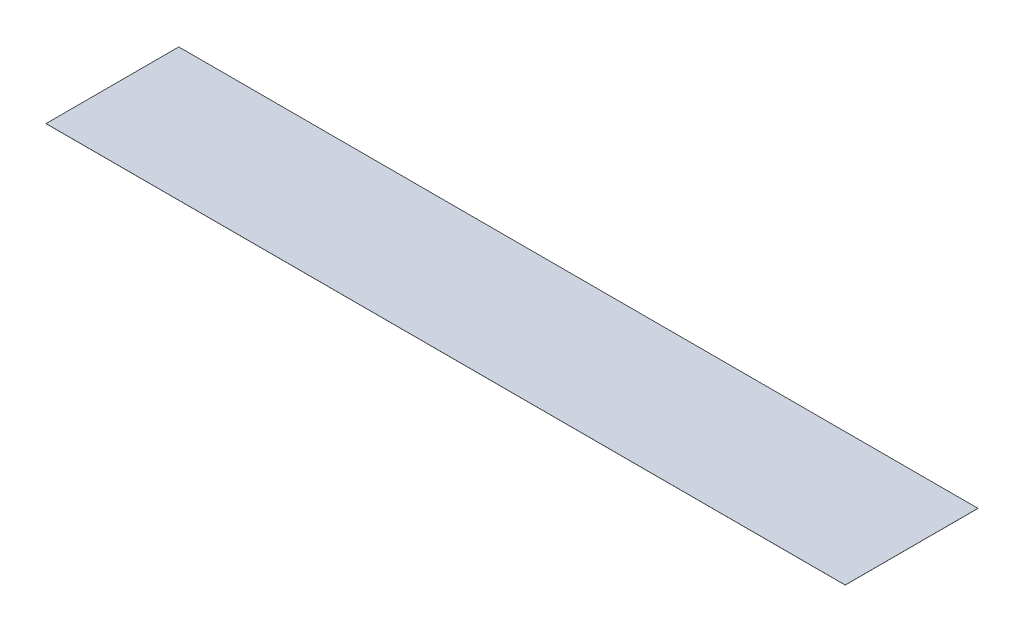
from build123d import *

# Parameters (mm, degrees)
ESBO_O1_W                 = 120.383511046
ESBO_O1_H                 = 20
RESSALTO_EXTRUS_O15_DEPTH = 0.01


with BuildPart() as part:
    # Esboço1 → Ressalto-extrusão15 (new body)
    with BuildSketch(Plane(origin=(0, 0, 0), x_dir=(1, 0, 0), z_dir=(0, 1, 0))):
        with Locations((-1774.508516518, 266.904977976)):
            Rectangle(ESBO_O1_W, ESBO_O1_H)
    extrude(amount=RESSALTO_EXTRUS_O15_DEPTH)


solid = part.part
